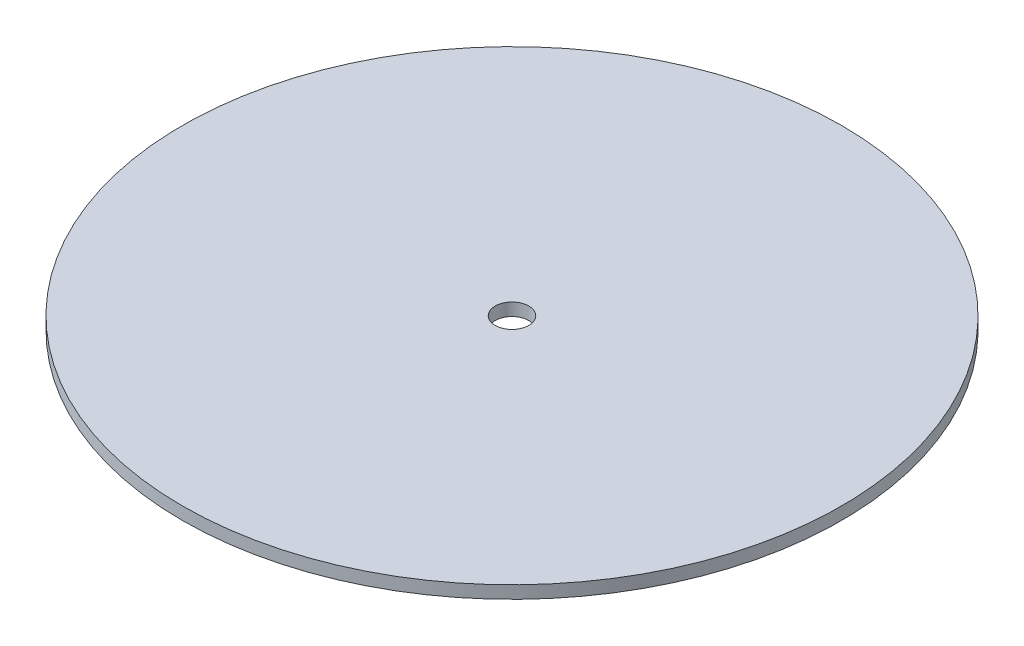
from build123d import *

# Parameters (mm, degrees)
SKETCH1_R           = 78.35
SKETCH1_R_2         = 4
BOSS_EXTRUDE1_DEPTH = 3


with BuildPart() as part:
    # Sketch1 → Boss-Extrude1 (new body)
    with BuildSketch(Plane(origin=(0, 0, 0), x_dir=(1, 0, 0), z_dir=(0, 1, 0))):
        with Locations(Location((0, 0, 0), (0, 0, 270))):
            Circle(SKETCH1_R)
        with Locations(Location((0, 0, 0), (0, 0, 270))):
            Circle(SKETCH1_R_2, mode=Mode.SUBTRACT)
    extrude(amount=BOSS_EXTRUDE1_DEPTH)


solid = part.part
